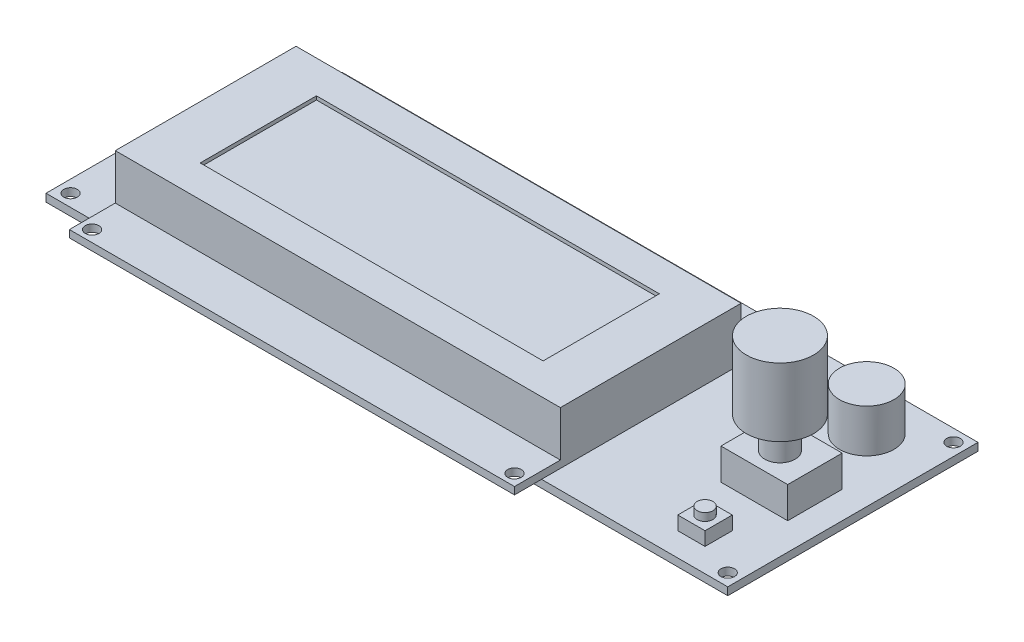
from build123d import *

# Parameters (mm, degrees)
SKETCH1_W            = 150.1
SKETCH1_H            = 55.1
SKETCH1_R            = 1.5
BOSS_EXTRUDE1_DEPTH  = 1.7
SKETCH2_W            = 40.8
SKETCH2_H            = 2.5
BOSS_EXTRUDE2_DEPTH  = 2.4
SKETCH3_W            = 98
SKETCH3_H            = 60
SKETCH3_R            = 1.5
BOSS_EXTRUDE3_DEPTH  = 1.6
SKETCH4_W            = 98
SKETCH4_H            = 39.8
BOSS_EXTRUDE4_DEPTH  = 10
SKETCH5_W            = 75.5
SKETCH5_H            = 25.6
CUT_EXTRUDE1_DEPTH   = 0.8
SKETCH6_R            = 6
BOSS_EXTRUDE5_DEPTH  = 9.5
SKETCH7_W            = 6
SKETCH7_H            = 6
BOSS_EXTRUDE6_DEPTH  = 3
SKETCH8_R            = 1.75
BOSS_EXTRUDE7_DEPTH  = 1.7
SKETCH9_W            = 14.7
SKETCH9_H            = 12
BOSS_EXTRUDE8_DEPTH  = 6.9
SKETCH10_R           = 3.35
BOSS_EXTRUDE9_DEPTH  = 6.9
SKETCH11_R           = 7.4
BOSS_EXTRUDE10_DEPTH = 15
SKETCH12_W           = 26.5
SKETCH12_H           = 26.5
BOSS_EXTRUDE11_DEPTH = 2.8
SKETCH13_R           = 4.6
BOSS_EXTRUDE12_DEPTH = 7.6
SKETCH14_W           = 43.1
SKETCH14_H           = 8.6
BOSS_EXTRUDE13_DEPTH = 18


with BuildPart() as part:
    # Sketch1 → Boss-Extrude1 (new body)
    with BuildSketch(Plane(origin=(0, 0, 0), x_dir=(1, 0, 0), z_dir=(0, 1, 0))):
        Rectangle(SKETCH1_W, SKETCH1_H)
        with Locations((-72.35, 24.85)):
            Circle(SKETCH1_R, mode=Mode.SUBTRACT)
        with Locations((-72.35, -24.85)):
            Circle(SKETCH1_R, mode=Mode.SUBTRACT)
        with Locations((72.35, 24.85)):
            Circle(SKETCH1_R, mode=Mode.SUBTRACT)
        with Locations((72.35, -24.85)):
            Circle(SKETCH1_R, mode=Mode.SUBTRACT)
    extrude(amount=BOSS_EXTRUDE1_DEPTH)

    # Sketch2 → Boss-Extrude2 (add)
    with BuildSketch(Plane(origin=(0, 1.7, 0), x_dir=(1, 0, 0), z_dir=(0, 1, 0))):
        with Locations((-32.85, 21.9)):
            Rectangle(SKETCH2_W, SKETCH2_H)
    extrude(amount=BOSS_EXTRUDE2_DEPTH)

    # Sketch3 → Boss-Extrude3 (add)
    with BuildSketch(Plane(origin=(0, 4.1, 0), x_dir=(1, 0, 0), z_dir=(0, 1, 0))):
        with Locations((-12.55, -5.9)):
            Rectangle(SKETCH3_W, SKETCH3_H)
        with Locations((-59.05, 21.6)):
            Circle(SKETCH3_R, mode=Mode.SUBTRACT)
        with Locations((33.95, 21.6)):
            Circle(SKETCH3_R, mode=Mode.SUBTRACT)
        with Locations((33.95, -33.4)):
            Circle(SKETCH3_R, mode=Mode.SUBTRACT)
        with Locations((-59.05, -33.4)):
            Circle(SKETCH3_R, mode=Mode.SUBTRACT)
    extrude(amount=BOSS_EXTRUDE3_DEPTH)

    # Sketch4 → Boss-Extrude4 (add)
    with BuildSketch(Plane(origin=(0, 5.7, 0), x_dir=(1, 0, 0), z_dir=(0, 1, 0))):
        with Locations((-12.55, -5.9)):
            Rectangle(SKETCH4_W, SKETCH4_H)
    extrude(amount=BOSS_EXTRUDE4_DEPTH)

    # Sketch5 → Cut-Extrude1 (cut)
    with BuildSketch(Plane(origin=(0, 15.7, 0), x_dir=(1, 0, 0), z_dir=(0, 1, 0))):
        with Locations((-12.1, -6)):
            Rectangle(SKETCH5_W, SKETCH5_H)
    extrude(amount=-CUT_EXTRUDE1_DEPTH, mode=Mode.SUBTRACT)

    # Sketch6 → Boss-Extrude5 (add)
    with BuildSketch(Plane(origin=(0, 1.7, 0), x_dir=(1, 0, 0), z_dir=(0, 1, 0))):
        with Locations((61.15, 16.95)):
            Circle(SKETCH6_R)
    extrude(amount=BOSS_EXTRUDE5_DEPTH)

    # Sketch7 → Boss-Extrude6 (add)
    with BuildSketch(Plane(origin=(0, 1.7, 0), x_dir=(1, 0, 0), z_dir=(0, 1, 0))):
        with Locations((61.85, -19.35)):
            Rectangle(SKETCH7_W, SKETCH7_H)
    extrude(amount=BOSS_EXTRUDE6_DEPTH)

    # Sketch8 → Boss-Extrude7 (add)
    with BuildSketch(Plane(origin=(0, 4.7, 0), x_dir=(1, 0, 0), z_dir=(0, 1, 0))):
        with Locations((61.85, -19.35)):
            Circle(SKETCH8_R)
    extrude(amount=BOSS_EXTRUDE7_DEPTH)

    # Sketch9 → Boss-Extrude8 (add)
    with BuildSketch(Plane(origin=(0, 1.7, 0), x_dir=(1, 0, 0), z_dir=(0, 1, 0))):
        with Locations((61.7, -2.35)):
            Rectangle(SKETCH9_W, SKETCH9_H)
    extrude(amount=BOSS_EXTRUDE8_DEPTH)

    # Sketch10 → Boss-Extrude9 (add)
    with BuildSketch(Plane(origin=(0, 8.6, 0), x_dir=(1, 0, 0), z_dir=(0, 1, 0))):
        with Locations((61.7, -2.7)):
            Circle(SKETCH10_R)
    extrude(amount=BOSS_EXTRUDE9_DEPTH)

    # Sketch11 → Boss-Extrude10 (add)
    with BuildSketch(Plane(origin=(0, 15.5, 0), x_dir=(1, 0, 0), z_dir=(0, 1, 0))):
        with Locations((61.7, -2.7)):
            Circle(SKETCH11_R)
    extrude(amount=BOSS_EXTRUDE10_DEPTH)

    # Sketch12 → Boss-Extrude11 (add)
    with BuildSketch(Plane(origin=(0, 0, 0), x_dir=(-1, 0, 0), z_dir=(0, -1, 0))):
        with Locations((61.8, -6.3)):
            Rectangle(SKETCH12_W, SKETCH12_H)
    extrude(amount=BOSS_EXTRUDE11_DEPTH)

    # Sketch13 → Boss-Extrude12 (add)
    with BuildSketch(Plane.XZ):
        with Locations((-62.15, -16.85)):
            Circle(SKETCH13_R)
    extrude(amount=BOSS_EXTRUDE12_DEPTH)

    # Sketch14 → Boss-Extrude13 (add)
    with BuildSketch(Plane.XZ):
        with Locations((-7.2, -0.95)):
            Rectangle(SKETCH14_W, SKETCH14_H)
    extrude(amount=BOSS_EXTRUDE13_DEPTH)


solid = part.part
